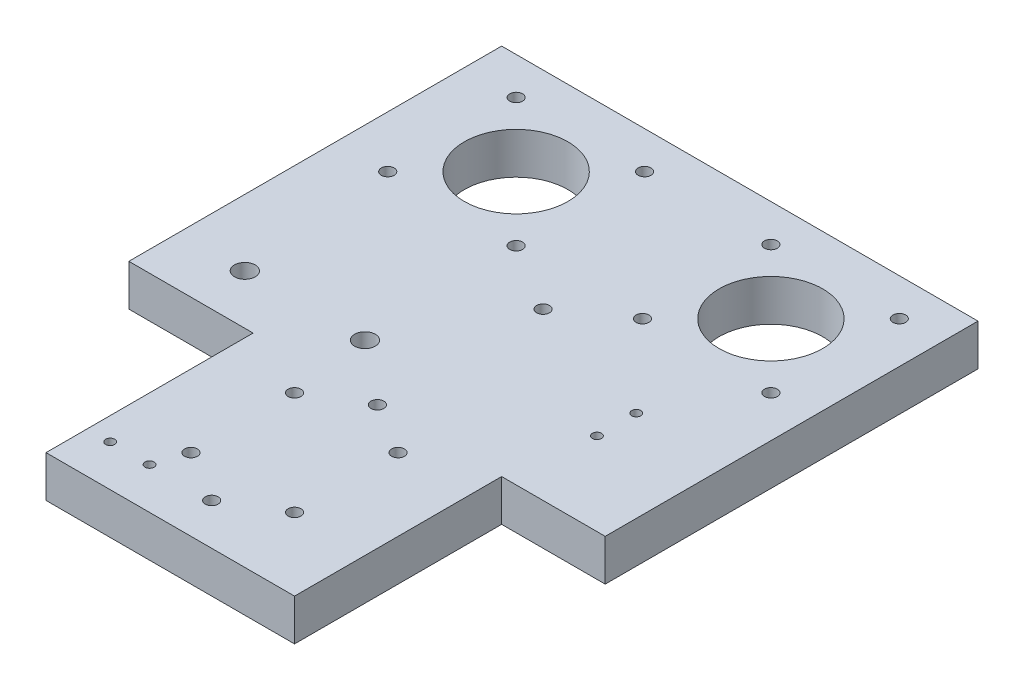
from build123d import *

# Parameters (mm, degrees)
SKETCH1_W           = 60
SKETCH1_H           = 140
BOSS_EXTRUDE1_DEPTH = 10
SKETCH3_R           = 1.55
CUT_EXTRUDE1_DEPTH  = 77.811457479
SKETCH4_R           = 1.55
CUT_EXTRUDE2_DEPTH  = 77.811457479
SKETCH7_W           = 25
SKETCH7_H           = 90
BOSS_EXTRUDE2_DEPTH = 10
SKETCH8_R           = 1.55
SKETCH8_R_2         = 12.5
CUT_EXTRUDE4_DEPTH  = 90.582364336
SKETCH9_W           = 30
SKETCH9_H           = 90
BOSS_EXTRUDE3_DEPTH = 10
SKETCH10_R          = 1.55
SKETCH10_R_2        = 12.5
CUT_EXTRUDE5_DEPTH  = 93.736184955
SKETCH11_R          = 2.5
CUT_EXTRUDE6_DEPTH  = 93.736184955
SKETCH12_R          = 1.1
CUT_EXTRUDE7_DEPTH  = 93.736184955
CUT_EXTRUDE8_REACH  = 94.736
SKETCH13_R          = 1.1


with BuildPart() as part:
    # Sketch1 → Boss-Extrude1 (new body)
    with BuildSketch(Plane(origin=(0, 0, 0), x_dir=(1, 0, 0), z_dir=(0, 1, 0))):
        Rectangle(SKETCH1_W, SKETCH1_H)
    extrude(amount=BOSS_EXTRUDE1_DEPTH)

    # Sketch3 → Cut-Extrude1 (cut, through all)
    with BuildSketch(Plane(origin=(0, 10, 0), x_dir=(1, 0, 0), z_dir=(0, 1, 0))):
        with Locations(Location((0, -60, 0), (0, 0, 270))):
            Circle(SKETCH3_R)
        with Locations(Location((0, -20, 0), (0, 0, 270))):
            Circle(SKETCH3_R)
        with Locations(Location((0, 20, 0), (0, 0, 270))):
            Circle(SKETCH3_R)
    extrude(amount=-CUT_EXTRUDE1_DEPTH, mode=Mode.SUBTRACT)

    # Sketch4 → Cut-Extrude2 (cut, through all)
    with BuildSketch(Plane(origin=(0, 10, 0), x_dir=(1, 0, 0), z_dir=(0, 1, 0))):
        with Locations(Location((12.5, -27.5, 0), (0, 0, 270))):
            Circle(SKETCH4_R)
        with Locations(Location((12.5, -52.5, 0), (0, 0, 270))):
            Circle(SKETCH4_R)
        with Locations(Location((-12.5, -27.5, 0), (0, 0, 270))):
            Circle(SKETCH4_R)
        with Locations(Location((-12.5, -52.5, 0), (0, 0, 270))):
            Circle(SKETCH4_R)
    extrude(amount=-CUT_EXTRUDE2_DEPTH, mode=Mode.SUBTRACT)

    # Sketch7 → Boss-Extrude2 (add)
    with BuildSketch(Plane(origin=(0, 10, 0), x_dir=(1, 0, 0), z_dir=(0, 1, 0))):
        with Locations((42.5, 25)):
            Rectangle(SKETCH7_W, SKETCH7_H)
    extrude(amount=-BOSS_EXTRUDE2_DEPTH)

    # Sketch8 → Cut-Extrude4 (cut, through all)
    with BuildSketch(Plane(origin=(0, 10, 0), x_dir=(1, 0, 0), z_dir=(0, 1, 0))):
        with Locations(Location((14, 30, 0), (0, 0, 270))):
            Circle(SKETCH8_R)
        with Locations(Location((45, 30, 0), (0, 0, 270))):
            Circle(SKETCH8_R)
        with Locations(Location((45, 61, 0), (0, 0, 270))):
            Circle(SKETCH8_R)
        with Locations(Location((14, 61, 0), (0, 0, 270))):
            Circle(SKETCH8_R)
        with Locations(Location((29.5, 45.5, 0), (0, 0, 270))):
            Circle(SKETCH8_R_2)
    extrude(amount=-CUT_EXTRUDE4_DEPTH, mode=Mode.SUBTRACT)

    # Sketch9 → Boss-Extrude3 (add)
    with BuildSketch(Plane(origin=(0, 10, 0), x_dir=(1, 0, 0), z_dir=(0, 1, 0))):
        with Locations((-45, 25)):
            Rectangle(SKETCH9_W, SKETCH9_H)
    extrude(amount=-BOSS_EXTRUDE3_DEPTH)

    # Sketch10 → Cut-Extrude5 (cut, through all)
    with BuildSketch(Plane(origin=(0, 10, 0), x_dir=(1, 0, 0), z_dir=(0, 1, 0))):
        with Locations(Location((-47.5, 61, 0), (0, 0, 270))):
            Circle(SKETCH10_R)
        with Locations(Location((-16.5, 61, 0), (0, 0, 270))):
            Circle(SKETCH10_R)
        with Locations(Location((-16.5, 30, 0), (0, 0, 270))):
            Circle(SKETCH10_R)
        with Locations(Location((-47.5, 30, 0), (0, 0, 270))):
            Circle(SKETCH10_R)
        with Locations(Location((-32, 45.5, 0), (0, 0, 270))):
            Circle(SKETCH10_R_2)
    extrude(amount=-CUT_EXTRUDE5_DEPTH, mode=Mode.SUBTRACT)

    # Sketch11 → Cut-Extrude6 (cut, through all)
    with BuildSketch(Plane(origin=(0, 10, 0), x_dir=(1, 0, 0), z_dir=(0, 1, 0))):
        with Locations(Location((-44, -8, 0), (0, 0, 270))):
            Circle(SKETCH11_R)
        with Locations(Location((-15, -8, 0), (0, 0, 270))):
            Circle(SKETCH11_R)
    extrude(amount=-CUT_EXTRUDE6_DEPTH, mode=Mode.SUBTRACT)

    # Sketch12 → Cut-Extrude7 (cut, through all)
    with BuildSketch(Plane(origin=(0, 10, 0), x_dir=(1, 0, 0), z_dir=(0, 1, 0))):
        with Locations(Location((-24.5, -60, 0), (0, 0, 270))):
            Circle(SKETCH12_R)
        with Locations(Location((-15, -60, 0), (0, 0, 270))):
            Circle(SKETCH12_R)
    extrude(amount=-CUT_EXTRUDE7_DEPTH, mode=Mode.SUBTRACT)

    # Sketch13 → Cut-Extrude8 (cut, up to next)
    with BuildSketch(Plane.XZ, mode=Mode.PRIVATE) as cut_extrude8_sk1:
        with Locations(Location((33, -9.5, 0), (0, 0, 270))):
            Circle(SKETCH13_R)
    cut_extrude8_tool1 = extrude(cut_extrude8_sk1.sketch, amount=-CUT_EXTRUDE8_REACH, mode=Mode.PRIVATE) & part.part
    # Sketch13 → Cut-Extrude8 (cut, up to next)
    with BuildSketch(Plane.XZ, mode=Mode.PRIVATE) as cut_extrude8_sk2:
        with Locations(Location((33, 0, 0), (0, 0, 270))):
            Circle(SKETCH13_R)
    cut_extrude8_tool2 = extrude(cut_extrude8_sk2.sketch, amount=-CUT_EXTRUDE8_REACH, mode=Mode.PRIVATE) & part.part
    add(cut_extrude8_tool1.solids().sort_by_distance((33, 0, -9.5))[0], mode=Mode.SUBTRACT)
    add(cut_extrude8_tool2.solids().sort_by_distance((33, 0, 0))[0], mode=Mode.SUBTRACT)


solid = part.part
